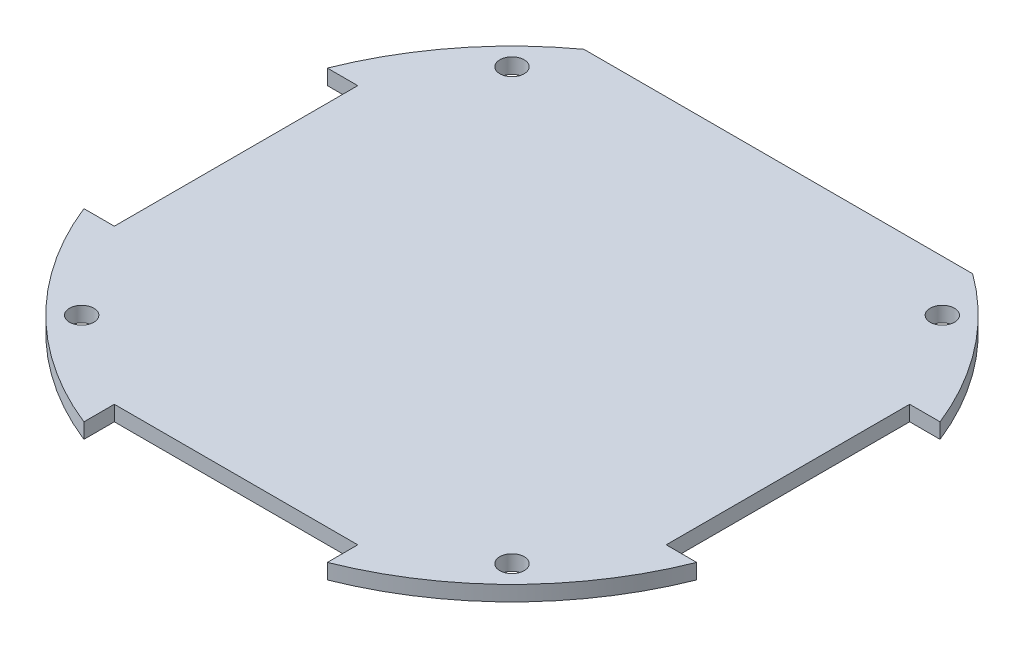
from build123d import *

# Parameters (mm, degrees)
SKETCH_1_R          = 32.5
SKETCH_1_R_2        = 1.2
EXTRUDE_1_DEPTH     = 1.5
CUT_EXTRUDE_1_DEPTH = 46.986411036
CUT_EXTRUDE_2_DEPTH = 43.74049602
SKETCH_4_R          = 1.5
SKETCH_4_R_2        = 1
CUT_EXTRUDE_3_DEPTH = 0.1


with BuildPart() as part:
    # 草图1 → 凸台-拉伸1 (new body)
    with BuildSketch(Plane(origin=(0, 0, 0), x_dir=(1, 0, 0), z_dir=(0, 1, 0))):
        with Locations(Location((0, 0, 0), (0, 0, 270))):
            Circle(SKETCH_1_R)
        with Locations(Location((21.213203436, 21.213203436, 0), (0, 0, 270))):
            Circle(SKETCH_1_R_2, mode=Mode.SUBTRACT)
        with Locations(Location((21.213203436, -21.213203436, 0), (0, 0, 270))):
            Circle(SKETCH_1_R_2, mode=Mode.SUBTRACT)
        with Locations(Location((-21.213203436, -21.213203436, 0), (0, 0, 270))):
            Circle(SKETCH_1_R_2, mode=Mode.SUBTRACT)
        with Locations(Location((-21.213203436, 21.213203436, 0), (0, 0, 270))):
            Circle(SKETCH_1_R_2, mode=Mode.SUBTRACT)
    extrude(amount=EXTRUDE_1_DEPTH)

    # 草图2 → 切除-拉伸1 (cut, through all)
    with BuildSketch(Plane(origin=(0, 1.5, 0), x_dir=(1, 0, 0), z_dir=(0, 1, 0))):
        with BuildLine():
            Line((30.203476621, 12), (27.203476621, 12))
            Line((27.203476621, 12), (27.203476621, -12))
            Line((27.203476621, -12), (30.203476621, -12))
            ThreePointArc((30.203476621, -12), (32.5, 0), (30.203476621, 12))
        make_face()
        with BuildLine():
            Line((12, -27.203476621), (-12, -27.203476621))
            Line((-12, -27.203476621), (-12, -30.203476621))
            ThreePointArc((-12, -30.203476621), (0, -32.5), (12, -30.203476621))
            Line((12, -30.203476621), (12, -27.203476621))
        make_face()
        with BuildLine():
            Line((-27.203476621, -12), (-27.203476621, 12))
            Line((-27.203476621, 12), (-30.203476621, 12))
            ThreePointArc((-30.203476621, 12), (-32.5, 0), (-30.203476621, -12))
            Line((-30.203476621, -12), (-27.203476621, -12))
        make_face()
        with BuildLine():
            Line((-12, 27.203476621), (12, 27.203476621))
            Line((12, 27.203476621), (12, 30.203476621))
            ThreePointArc((12, 30.203476621), (0, 32.5), (-12, 30.203476621))
            Line((-12, 30.203476621), (-12, 27.203476621))
        make_face()
    extrude(amount=-CUT_EXTRUDE_1_DEPTH, mode=Mode.SUBTRACT)

    # 草图3 → 切除-拉伸2 (cut, through all)
    with BuildSketch(Plane(origin=(0, 1.5, 0), x_dir=(1, 0, 0), z_dir=(0, 1, 0))):
        Polygon((17, 26.25), (-17, 26.25), (-27.149655647, 26.25), (-14.240374978, 46.745445694), (28.149411973, 26.25), align=None)
    extrude(amount=-CUT_EXTRUDE_2_DEPTH, mode=Mode.SUBTRACT)

    # 草图4 → 切除-拉伸3 (cut)
    with BuildSketch(Plane.XZ):
        with Locations(Location((3, 22.203476621, 0), (0, 0, 270))):
            Circle(SKETCH_4_R)
        with Locations(Location((3, 18.203476621, 0), (0, 0, 270))):
            Circle(SKETCH_4_R)
        with Locations(Location((-6, 24.203476621, 0), (0, 0, 270))):
            Circle(SKETCH_4_R_2)
        with Locations(Location((-3, 24.203476621, 0), (0, 0, 270))):
            Circle(SKETCH_4_R_2)
        with Locations(Location((-3, 21.203476621, 0), (0, 0, 270))):
            Circle(SKETCH_4_R_2)
        with Locations(Location((-6, 21.203476621, 0), (0, 0, 270))):
            Circle(SKETCH_4_R_2)
    extrude(amount=-CUT_EXTRUDE_3_DEPTH, mode=Mode.SUBTRACT)


solid = part.part
